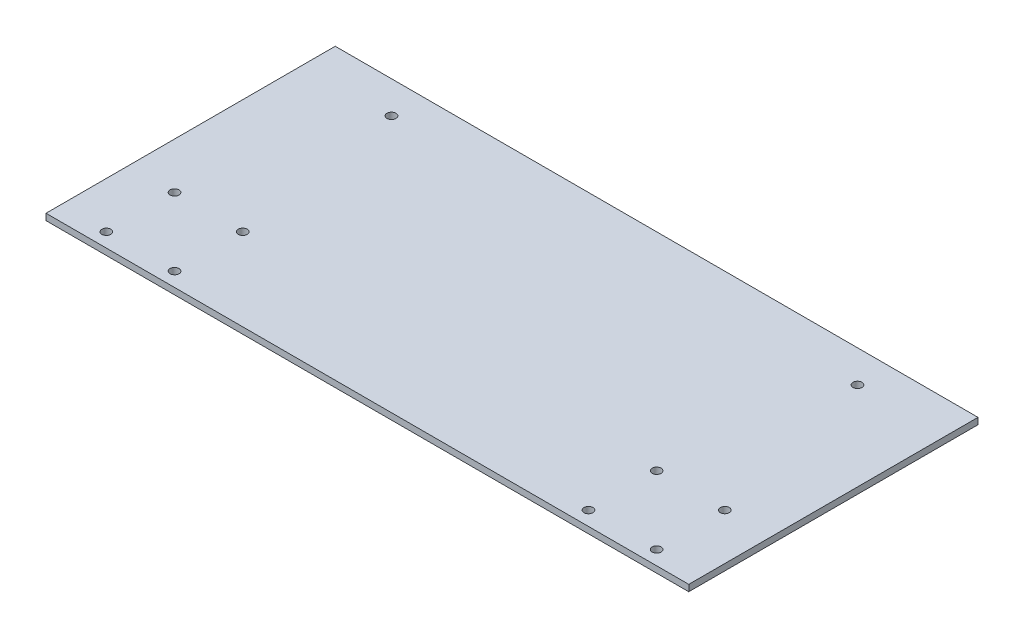
from build123d import *

# Parameters (mm, degrees)
SKETCH2_W           = 254
SKETCH2_H           = 114.3
SKETCH2_R           = 1.778
BOSS_EXTRUDE1_DEPTH = 2.54


with BuildPart() as part:
    # Sketch2 → Boss-Extrude1 (new body)
    with BuildSketch(Plane(origin=(0, 0, 0), x_dir=(1, 0, 0), z_dir=(0, 1, 0))):
        Rectangle(SKETCH2_W, SKETCH2_H)
        with Locations(Location((-108.720384182, -24.629615818, 0), (0, 0, 270))):
            Circle(SKETCH2_R, mode=Mode.SUBTRACT)
        with Locations(Location((-81.779615818, -24.629615818, 0), (0, 0, 270))):
            Circle(SKETCH2_R, mode=Mode.SUBTRACT)
        with Locations(Location((-108.720384182, -51.570384182, 0), (0, 0, 270))):
            Circle(SKETCH2_R, mode=Mode.SUBTRACT)
        with Locations(Location((108.720384182, -24.629615818, 0), (0, 0, 270))):
            Circle(SKETCH2_R, mode=Mode.SUBTRACT)
        with Locations(Location((81.779615818, -24.629615818, 0), (0, 0, 270))):
            Circle(SKETCH2_R, mode=Mode.SUBTRACT)
        with Locations(Location((108.720384182, -51.570384182, 0), (0, 0, 270))):
            Circle(SKETCH2_R, mode=Mode.SUBTRACT)
        with Locations(Location((81.779615818, -51.570384182, 0), (0, 0, 270))):
            Circle(SKETCH2_R, mode=Mode.SUBTRACT)
        with Locations(Location((-81.779615818, -51.570384182, 0), (0, 0, 270))):
            Circle(SKETCH2_R, mode=Mode.SUBTRACT)
        with Locations(Location((-92.075, 44.45, 0), (0, 0, 270))):
            Circle(SKETCH2_R, mode=Mode.SUBTRACT)
        with Locations(Location((92.075, 44.45, 0), (0, 0, 270))):
            Circle(SKETCH2_R, mode=Mode.SUBTRACT)
    extrude(amount=BOSS_EXTRUDE1_DEPTH)


solid = part.part
